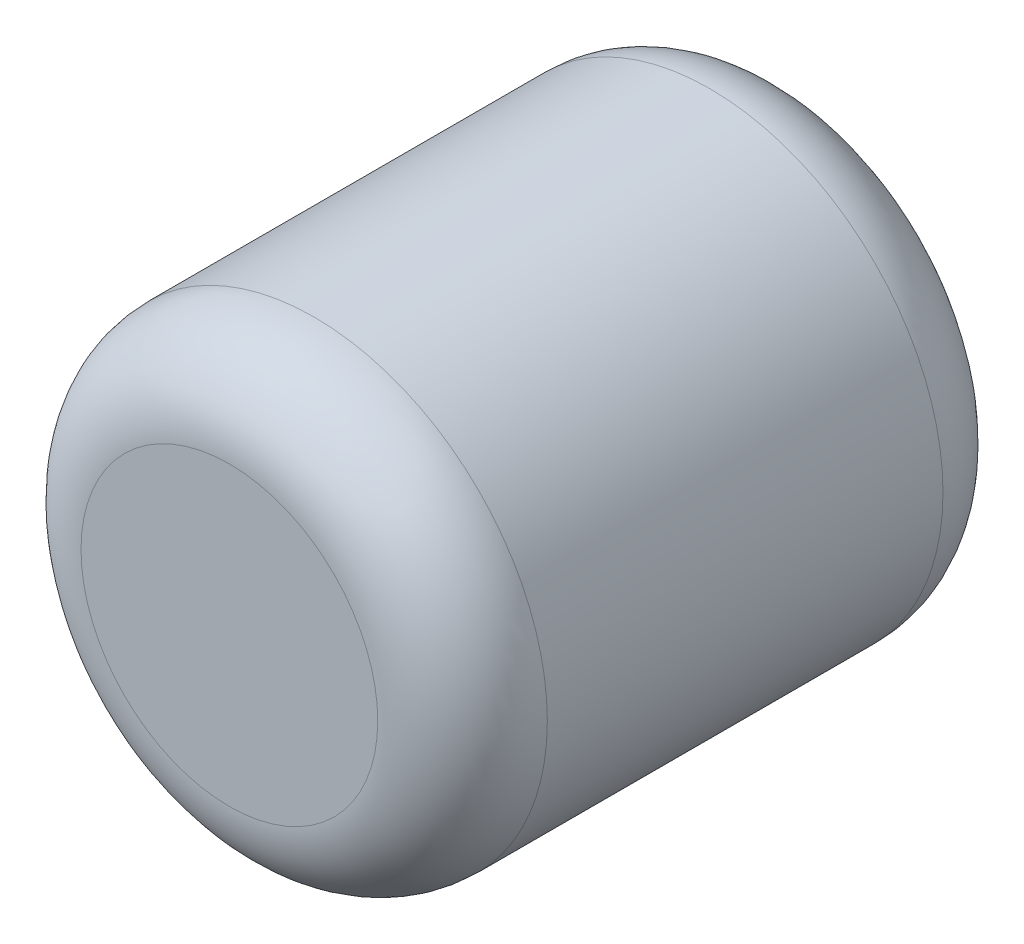
from build123d import *

# Parameters (mm, degrees)
SKETCH2_R           = 8.25
BOSS_EXTRUDE1_DEPTH = 20
FILLET1_R           = 3


with BuildPart() as part:
    # Sketch2 → Boss-Extrude1 (new body)
    with BuildSketch(Plane.XY):
        Circle(SKETCH2_R)
    extrude(amount=BOSS_EXTRUDE1_DEPTH)

    # Fillet1
    fillet1_edges = [part.edges().sort_by_distance(p)[0] for p in [
        (-8.25, 0, 0),
        (-8.25, 0, 20),
    ]]
    fillet(fillet1_edges, radius=FILLET1_R)


solid = part.part
